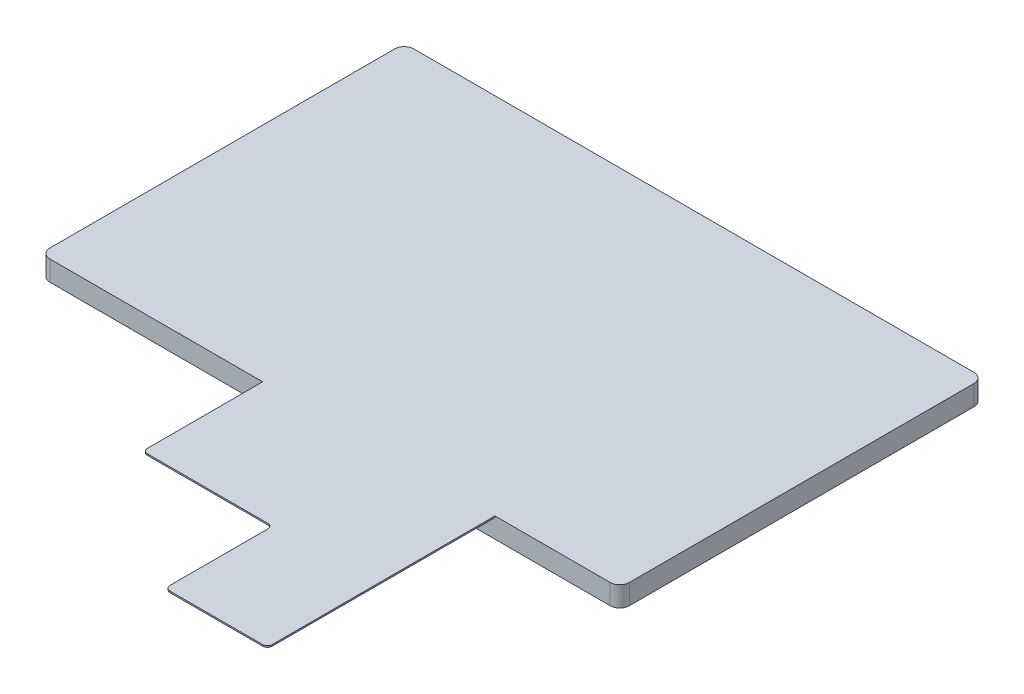
from build123d import *

# Parameters (mm, degrees)
SKETCH1_W           = 120.7
SKETCH1_H           = 75.8
BOSS_EXTRUDE1_DEPTH = 4.2
SKETCH2_W           = 48.4
SKETCH2_H           = 47.4
BOSS_EXTRUDE2_DEPTH = 0.3
SKETCH4_W           = 27.08
SKETCH4_H           = 22.41
CUT_EXTRUDE1_DEPTH  = 0.3
FILLET2_R           = 1
FILLET3_R           = 2


with BuildPart() as part:
    # Sketch1 → Boss-Extrude1 (new body)
    with BuildSketch(Plane(origin=(0, 0, 0), x_dir=(1, 0, 0), z_dir=(0, 1, 0))):
        with Locations((60.35, -37.9)):
            Rectangle(SKETCH1_W, SKETCH1_H)
    extrude(amount=BOSS_EXTRUDE1_DEPTH)

    # Sketch2 → Boss-Extrude2 (add)
    with BuildSketch(Plane(origin=(0, 4.2, 0), x_dir=(1, 0, 0), z_dir=(0, 1, 0))):
        with Locations((70.5, -99.5)):
            Rectangle(SKETCH2_W, SKETCH2_H)
    extrude(amount=-BOSS_EXTRUDE2_DEPTH)

    # Sketch4 → Cut-Extrude1 (cut)
    with BuildSketch(Plane.XZ.offset(-3.9)):
        with Locations((59.84, 111.995)):
            Rectangle(SKETCH4_W, SKETCH4_H)
    extrude(amount=-CUT_EXTRUDE1_DEPTH, mode=Mode.SUBTRACT)

    # Fillet2
    fillet2_edges = [part.edges().sort_by_distance(p)[0] for p in [
        (94.7, 4.05, 123.2),
        (46.3, 4.05, 100.79),
        (73.38, 4.05, 123.2),
        (73.38, 4.05, 100.79),
    ]]
    fillet(fillet2_edges, radius=FILLET2_R)

    # Fillet3
    fillet3_edges = [part.edges().sort_by_distance(p)[0] for p in [
        (0, 2.1, 0),
        (120.7, 2.1, 0),
        (120.7, 2.1, 75.8),
        (0, 2.1, 75.8),
    ]]
    fillet(fillet3_edges, radius=FILLET3_R)


solid = part.part
